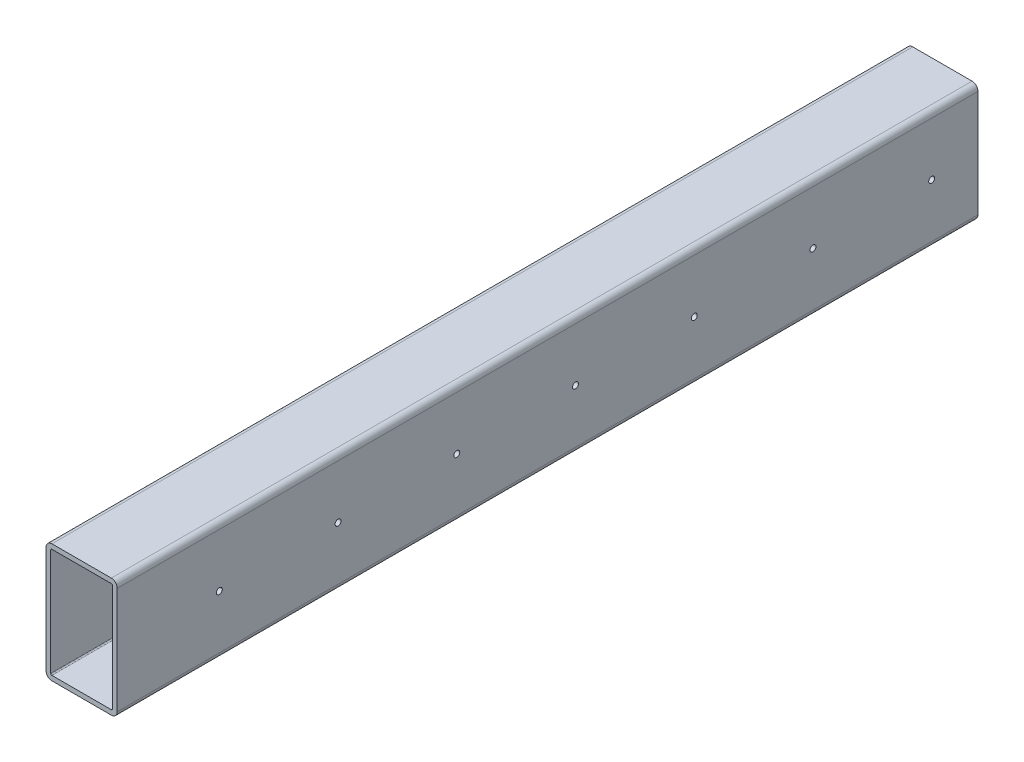
from build123d import *

# Parameters (mm, degrees)
TUBE_SQUARE_TS3X3X0_3125_1_DEPTH = 1450
SKETCH7_R                        = 5
CUT_EXTRUDE1_DEPTH               = 742.636703515


with BuildPart() as part:
    # Sketch1 → Tube square TS3X3X0.3125(1) (new body)
    with BuildSketch(Plane(origin=(0, 0, -725), x_dir=(0, -1, 0), z_dir=(0, 0, 1))):
        with BuildLine():
            Line((-90, -60), (90, -60))
            ThreePointArc((90, -60), (97.071067812, -57.071067812), (100, -50))
            Line((100, -50), (100, 50))
            ThreePointArc((100, 50), (97.071067812, 57.071067812), (90, 60))
            Line((90, 60), (-90, 60))
            ThreePointArc((-90, 60), (-97.071067812, 57.071067812), (-100, 50))
            Line((-100, 50), (-100, -50))
            ThreePointArc((-100, -50), (-97.071067812, -57.071067812), (-90, -60))
        make_face()
        with BuildLine():
            Line((-90, -52), (90, -52))
            ThreePointArc((90, -52), (91.414213562, -51.414213562), (92, -50))
            Line((92, -50), (92, 50))
            ThreePointArc((92, 50), (91.414213562, 51.414213562), (90, 52))
            Line((90, 52), (-90, 52))
            ThreePointArc((-90, 52), (-91.414213562, 51.414213562), (-92, 50))
            Line((-92, 50), (-92, -50))
            ThreePointArc((-92, -50), (-91.414213562, -51.414213562), (-90, -52))
        make_face(mode=Mode.SUBTRACT)
    extrude(amount=TUBE_SQUARE_TS3X3X0_3125_1_DEPTH)

    # Sketch7 → Cut-Extrude1 (cut, through all)
    with BuildSketch(Plane(origin=(60, 0, 0), x_dir=(0, 0, -1), z_dir=(1, 0, 0))):
        with Locations(Location((647, 0, 0), (0, 0, 90))):
            Circle(SKETCH7_R)
        with Locations(Location((447, 0, 0), (0, 0, 90))):
            Circle(SKETCH7_R)
        with Locations(Location((247, 0, 0), (0, 0, 90))):
            Circle(SKETCH7_R)
        with Locations(Location((47, 0, 0), (0, 0, 90))):
            Circle(SKETCH7_R)
        with Locations(Location((-153, 0, 0), (0, 0, 90))):
            Circle(SKETCH7_R)
        with Locations(Location((-353, 0, 0), (0, 0, 90))):
            Circle(SKETCH7_R)
        with Locations(Location((-553, 0, 0), (0, 0, 90))):
            Circle(SKETCH7_R)
    extrude(amount=-CUT_EXTRUDE1_DEPTH, mode=Mode.SUBTRACT)


solid = part.part
